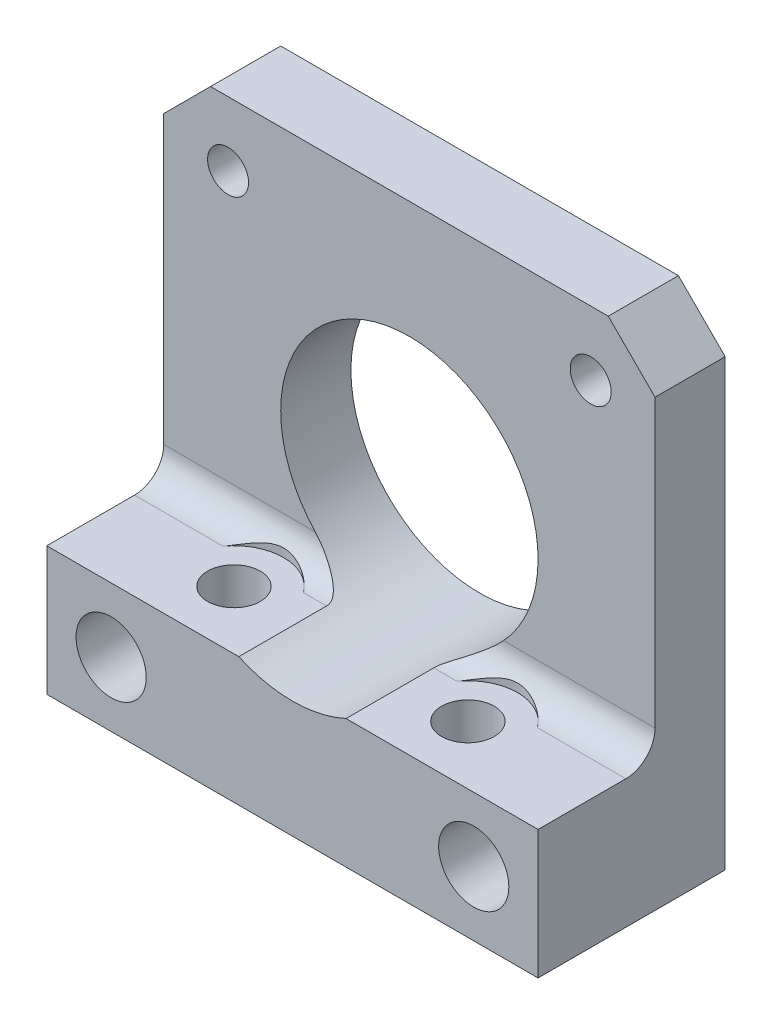
from build123d import *

# Parameters (mm, degrees)
ESBO_O1_W                = 42
ESBO_O1_H                = 42
RESSALTO_EXTRUS_O3_DEPTH = 6
ESBO_O7_W                = 42
ESBO_O7_H                = 11
RESSALTO_EXTRUS_O4_DEPTH = 10
CORTE_EXTRUS_O3_REACH    = 35.734
ESBO_O6_R                = 11
ESBO_O6_R_2              = 1.75
CHANFRO1_SIZE            = 4
FILETE1_R                = 2.5
ESBO_O8_R                = 2.25
CORTE_EXTRUS_O4_DEPTH    = 11
ESBO_O9_R                = 3
CORTE_EXTRUS_O5_DEPTH    = 10
CORTE_EXTRUS_O6_REACH    = 42.719
ESBO_O10_R               = 4.25


with BuildPart() as part:
    # Esboço1 → Ressalto-extrusão3 (new body)
    with BuildSketch(Plane.XY):
        Rectangle(ESBO_O1_W, ESBO_O1_H)
    extrude(amount=RESSALTO_EXTRUS_O3_DEPTH)

    # Esboço7 → Ressalto-extrusão4 (add)
    with BuildSketch(Plane.XY.offset(6)):
        with Locations((0, -15.5)):
            Rectangle(ESBO_O7_W, ESBO_O7_H)
    extrude(amount=RESSALTO_EXTRUS_O4_DEPTH)

    # Corte-extrusão3: up to this face of the body (flat: up to its plane)
    corte_extrus_o3_end = Plane(part.part.faces().sort_by_distance((0, -15.5, 16))[0])
    # Esboço6 → Corte-extrusão3 (cut, up to the picked face)
    with BuildSketch(Plane(origin=(0, 0, 0), x_dir=(-1, 0, 0), z_dir=(0, 0, -1)), mode=Mode.PRIVATE) as corte_extrus_o3_sk1:
        Circle(ESBO_O6_R)
    corte_extrus_o3_tool1 = split(extrude(corte_extrus_o3_sk1.sketch, amount=-CORTE_EXTRUS_O3_REACH, mode=Mode.PRIVATE), bisect_by=corte_extrus_o3_end, keep=Keep.BOTH, mode=Mode.PRIVATE)
    # Esboço6 → Corte-extrusão3 (cut, up to the picked face)
    with BuildSketch(Plane(origin=(0, 0, 0), x_dir=(-1, 0, 0), z_dir=(0, 0, -1)), mode=Mode.PRIVATE) as corte_extrus_o3_sk2:
        with Locations((-15.5, 15.5)):
            Circle(ESBO_O6_R_2)
    corte_extrus_o3_tool2 = split(extrude(corte_extrus_o3_sk2.sketch, amount=-CORTE_EXTRUS_O3_REACH, mode=Mode.PRIVATE), bisect_by=corte_extrus_o3_end, keep=Keep.BOTH, mode=Mode.PRIVATE)
    # Esboço6 → Corte-extrusão3 (cut, up to the picked face)
    with BuildSketch(Plane(origin=(0, 0, 0), x_dir=(-1, 0, 0), z_dir=(0, 0, -1)), mode=Mode.PRIVATE) as corte_extrus_o3_sk3:
        with Locations((15.5, 15.5)):
            Circle(ESBO_O6_R_2)
    corte_extrus_o3_tool3 = split(extrude(corte_extrus_o3_sk3.sketch, amount=-CORTE_EXTRUS_O3_REACH, mode=Mode.PRIVATE), bisect_by=corte_extrus_o3_end, keep=Keep.BOTH, mode=Mode.PRIVATE)
    # Esboço6 → Corte-extrusão3 (cut, up to the picked face)
    with BuildSketch(Plane(origin=(0, 0, 0), x_dir=(-1, 0, 0), z_dir=(0, 0, -1)), mode=Mode.PRIVATE) as corte_extrus_o3_sk4:
        with Locations((15.5, -15.5)):
            Circle(ESBO_O6_R_2)
    corte_extrus_o3_tool4 = split(extrude(corte_extrus_o3_sk4.sketch, amount=-CORTE_EXTRUS_O3_REACH, mode=Mode.PRIVATE), bisect_by=corte_extrus_o3_end, keep=Keep.BOTH, mode=Mode.PRIVATE)
    # Esboço6 → Corte-extrusão3 (cut, up to the picked face)
    with BuildSketch(Plane(origin=(0, 0, 0), x_dir=(-1, 0, 0), z_dir=(0, 0, -1)), mode=Mode.PRIVATE) as corte_extrus_o3_sk5:
        with Locations((-15.5, -15.5)):
            Circle(ESBO_O6_R_2)
    corte_extrus_o3_tool5 = split(extrude(corte_extrus_o3_sk5.sketch, amount=-CORTE_EXTRUS_O3_REACH, mode=Mode.PRIVATE), bisect_by=corte_extrus_o3_end, keep=Keep.BOTH, mode=Mode.PRIVATE)
    add(corte_extrus_o3_tool1.solids().sort_by(Axis((0, 0, 0), (0, 0, 1)))[0], mode=Mode.SUBTRACT)
    add(corte_extrus_o3_tool2.solids().sort_by(Axis((15.5, 15.5, 0), (0, 0, 1)))[0], mode=Mode.SUBTRACT)
    add(corte_extrus_o3_tool3.solids().sort_by(Axis((-15.5, 15.5, 0), (0, 0, 1)))[0], mode=Mode.SUBTRACT)
    add(corte_extrus_o3_tool4.solids().sort_by(Axis((-15.5, -15.5, 0), (0, 0, 1)))[0], mode=Mode.SUBTRACT)
    add(corte_extrus_o3_tool5.solids().sort_by(Axis((15.5, -15.5, 0), (0, 0, 1)))[0], mode=Mode.SUBTRACT)

    # Chanfro1
    chanfro1_edges = [part.edges().sort_by_distance(p)[0] for p in [
        (-21, 21, 3),
        (21, 21, 3),
    ]]
    chamfer(chanfro1_edges, length=CHANFRO1_SIZE)

    # Filete1
    filete1_edges = [part.edges().sort_by_distance(p)[0] for p in [
        (12.791287847, -10, 6),
        (-12.791287847, -10, 6),
    ]]
    fillet(filete1_edges, radius=FILETE1_R)

    # Esboço8 → Corte-extrusão4 (cut)
    with BuildSketch(Plane.XZ.offset(21)):
        with Locations((-10, 11)):
            Circle(ESBO_O8_R)
        with Locations((10, 11)):
            Circle(ESBO_O8_R)
    extrude(amount=-CORTE_EXTRUS_O4_DEPTH, mode=Mode.SUBTRACT)

    # Esboço9 → Corte-extrusão5 (cut)
    with BuildSketch(Plane.XY.offset(16)):
        with Locations((-15.5, -15.5)):
            Circle(ESBO_O9_R)
        with Locations((15.5, -15.5)):
            Circle(ESBO_O9_R)
    extrude(amount=-CORTE_EXTRUS_O5_DEPTH, mode=Mode.SUBTRACT)

    # Esboço10 → Corte-extrusão6 (cut, up to next)
    with BuildSketch(Plane(origin=(0, -10, 0), x_dir=(1, 0, 0), z_dir=(0, 1, 0)), mode=Mode.PRIVATE) as corte_extrus_o6_sk1:
        with Locations((10, -11)):
            Circle(ESBO_O10_R)
    corte_extrus_o6_tool1 = extrude(corte_extrus_o6_sk1.sketch, amount=CORTE_EXTRUS_O6_REACH, mode=Mode.PRIVATE) & part.part
    # Esboço10 → Corte-extrusão6 (cut, up to next)
    with BuildSketch(Plane(origin=(0, -10, 0), x_dir=(1, 0, 0), z_dir=(0, 1, 0)), mode=Mode.PRIVATE) as corte_extrus_o6_sk2:
        with Locations((-10, -11)):
            Circle(ESBO_O10_R)
    corte_extrus_o6_tool2 = extrude(corte_extrus_o6_sk2.sketch, amount=CORTE_EXTRUS_O6_REACH, mode=Mode.PRIVATE) & part.part
    add(corte_extrus_o6_tool1.solids().sort_by_distance((10, -10, 11))[0], mode=Mode.SUBTRACT)
    add(corte_extrus_o6_tool2.solids().sort_by_distance((-10, -10, 11))[0], mode=Mode.SUBTRACT)


solid = part.part
